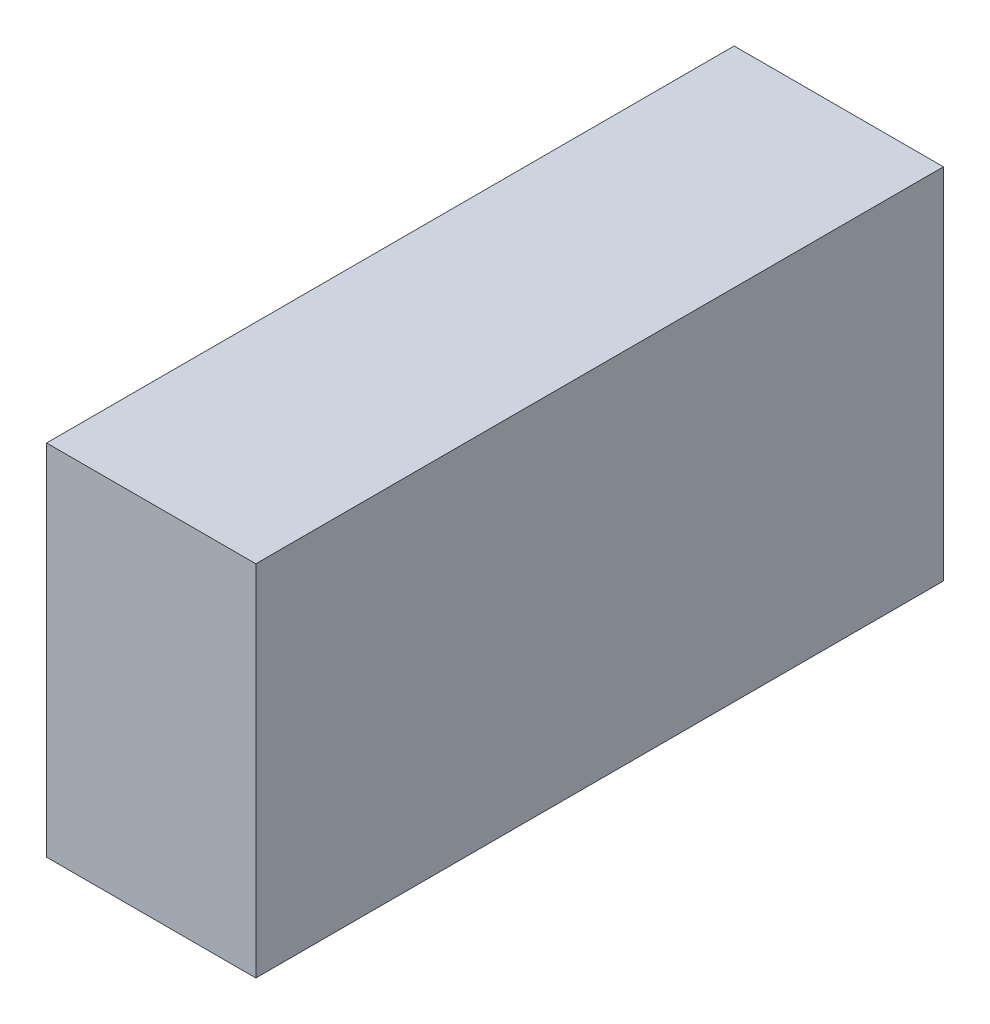
from build123d import *

# Parameters (mm, degrees)
SKETCH1_W           = 177.8
SKETCH1_H           = 304.8
BOSS_EXTRUDE1_DEPTH = 584.2


with BuildPart() as part:
    # Sketch1 → Boss-Extrude1 (new body)
    with BuildSketch(Plane.XY):
        Rectangle(SKETCH1_W, SKETCH1_H)
    extrude(amount=BOSS_EXTRUDE1_DEPTH)


solid = part.part
